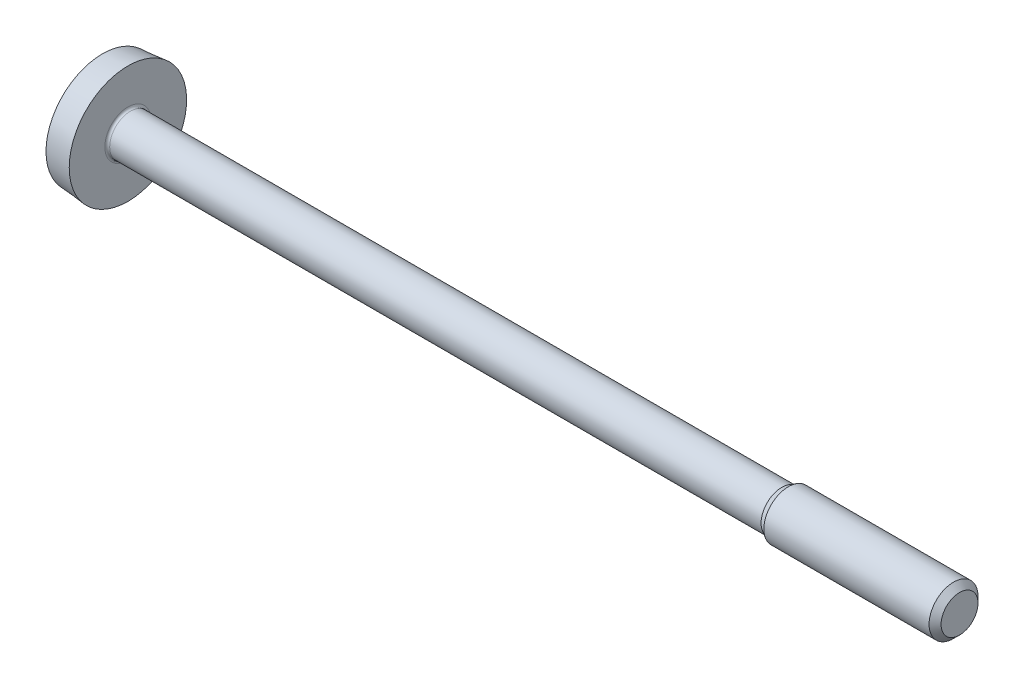
from build123d import *

# Parameters (mm, degrees)
CUT_EXTRUDE1_DEPTH = 0.6


with BuildPart() as part:
    # Sketch1 → Revolve1 (revolve)
    with BuildSketch(Plane.XY, mode=Mode.PRIVATE) as revolve1_sk:
        with BuildLine():
            Line((-1.04, 2.30901179), (0, 2.4))
            Line((0, 2.4), (0, 0.945))
            ThreePointArc((0, 0.945), (0.029289322, 0.874289322), (0.1, 0.845))
            Line((0.1, 0.845), (26.731532125, 0.845))
            Line((26.731532125, 0.845), (27, 1))
            Line((27, 1), (33.7545, 1))
            Line((33.7545, 1), (34, 0.7545))
            Line((34, 0.7545), (34, 0))
            Line((34, 0), (-1.6, 0))
            ThreePointArc((-1.6, 0), (-1.457999714, 1.187974689), (-1.04, 2.30901179))
        make_face()
    revolve(revolve1_sk.sketch.rotate(Axis((34, 0, 0), (-1, 0, 0)), 270), axis=Axis((34, 0, 0), (-1, 0, 0)))

    # Sketch2 → Cut-Extrude1 (cut)
    with BuildSketch(Plane(origin=(-1.04, 0, 0), x_dir=(0, 0, -1), z_dir=(1, 0, 0))):
        Polygon((-1, 0.29), (-1, -0.29), (-0.29, -0.29), (-0.29, -2.5), (0.29, -2.5), (0.29, -0.29), (1, -0.29), (1, 0.29), (0.29, 0.29), (0.29, 2.5), (-0.29, 2.5), (-0.29, 0.29), align=None)
    extrude(amount=-CUT_EXTRUDE1_DEPTH, mode=Mode.SUBTRACT)


solid = part.part
